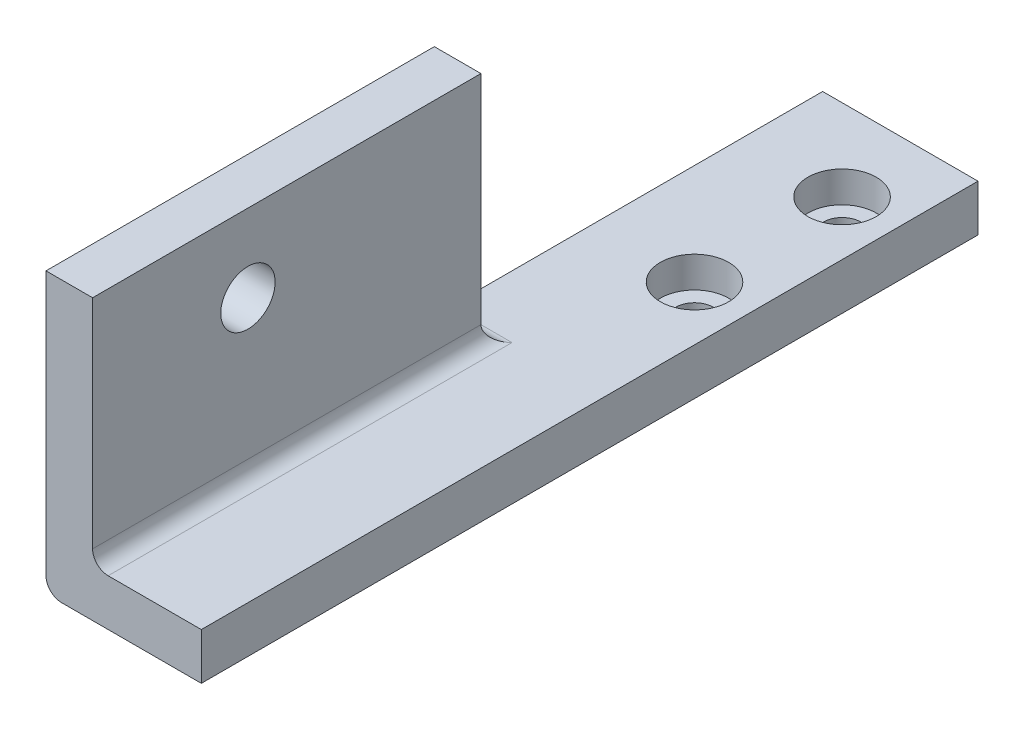
from build123d import *

# Parameters (mm, degrees)
SKETCH1_W                      = 10
SKETCH1_H                      = 20
SKETCH1_R                      = 1.175
BOSS_EXTRUDE1_DEPTH            = 3
CBORE_FOR_M2_SHCS1_D           = 2.4
CBORE_FOR_M2_SHCS1_CBORE_D     = 4.4
CBORE_FOR_M2_SHCS1_CBORE_DEPTH = 2
SKETCH6_W                      = 10
SKETCH6_H                      = 3
BOSS_EXTRUDE2_DEPTH            = 30
SKETCH8_W                      = 3
SKETCH8_H                      = 25
BOSS_EXTRUDE3_DEPTH            = 15
SKETCH9_R                      = 1.75
CUT_EXTRUDE1_DEPTH             = 36.67912555
FILLET1_R                      = 1
FILLET2_R                      = 1


with BuildPart() as part:
    # Sketch1 → Boss-Extrude1 (new body)
    with BuildSketch(Plane(origin=(0, 0, 0), x_dir=(1, 0, 0), z_dir=(0, 1, 0))):
        with Locations((5, 10)):
            Rectangle(SKETCH1_W, SKETCH1_H)
        with Locations(Location((6.5, 5.25, 0), (0, 0, 270))):
            Circle(SKETCH1_R, mode=Mode.SUBTRACT)
        with Locations(Location((6.5, 14.75, 0), (0, 0, 270))):
            Circle(SKETCH1_R, mode=Mode.SUBTRACT)
    extrude(amount=BOSS_EXTRUDE1_DEPTH)

    # CBORE for M2 SHCS1 (through all)
    with Locations(Plane(origin=(0, 3, 0), x_dir=(1, 0, 0), z_dir=(0, 1, 0))):
        with Locations((6.5, 14.75), (6.5, 5.25)):
            CounterBoreHole(CBORE_FOR_M2_SHCS1_D / 2, CBORE_FOR_M2_SHCS1_CBORE_D / 2, CBORE_FOR_M2_SHCS1_CBORE_DEPTH)

    # Sketch6 → Boss-Extrude2 (add)
    with BuildSketch(Plane(origin=(0, 0, 0), x_dir=(-1, 0, 0), z_dir=(0, 0, -1))):
        with Locations((-5, 1.5)):
            Rectangle(SKETCH6_W, SKETCH6_H)
    extrude(amount=-BOSS_EXTRUDE2_DEPTH)

    # Sketch8 → Boss-Extrude3 (add)
    with BuildSketch(Plane(origin=(0, 3, 0), x_dir=(1, 0, 0), z_dir=(0, 1, 0))):
        with Locations((1.5, -17.5)):
            Rectangle(SKETCH8_W, SKETCH8_H)
    extrude(amount=BOSS_EXTRUDE3_DEPTH)

    # Sketch9 → Cut-Extrude1 (cut, through all)
    with BuildSketch(Plane(origin=(3, 0, 0), x_dir=(0, 0, -1), z_dir=(1, 0, 0))):
        with Locations((-20, 13)):
            Circle(SKETCH9_R)
    extrude(amount=-CUT_EXTRUDE1_DEPTH, mode=Mode.SUBTRACT)

    # Fillet1
    fillet1_edges = [part.edges().sort_by_distance(p)[0] for p in [
        (3, 3, 17.5),
        (1.5, 3, 5),
    ]]
    fillet(fillet1_edges, radius=FILLET1_R)

    # Fillet2
    fillet2_edges = [part.edges().sort_by_distance(p)[0] for p in [
        (0, 0, 5),
    ]]
    fillet(fillet2_edges, radius=FILLET2_R)


solid = part.part
